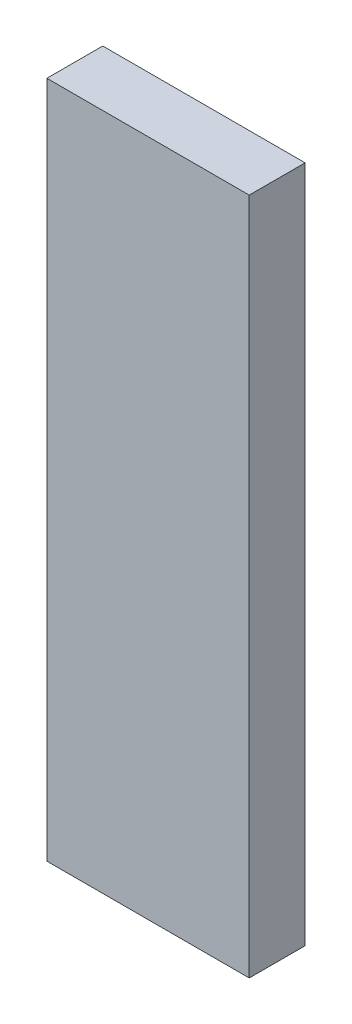
from build123d import *

# Parameters (mm, degrees)
SKETCH1_W      = 3.4036
SKETCH1_H      = 11.4046
EXTRUDE1_DEPTH = 0.9398


with BuildPart() as part:
    # Sketch1 → Extrude1 (new body)
    with BuildSketch(Plane.XY):
        Rectangle(SKETCH1_W, SKETCH1_H)
    extrude(amount=EXTRUDE1_DEPTH)


solid = part.part
